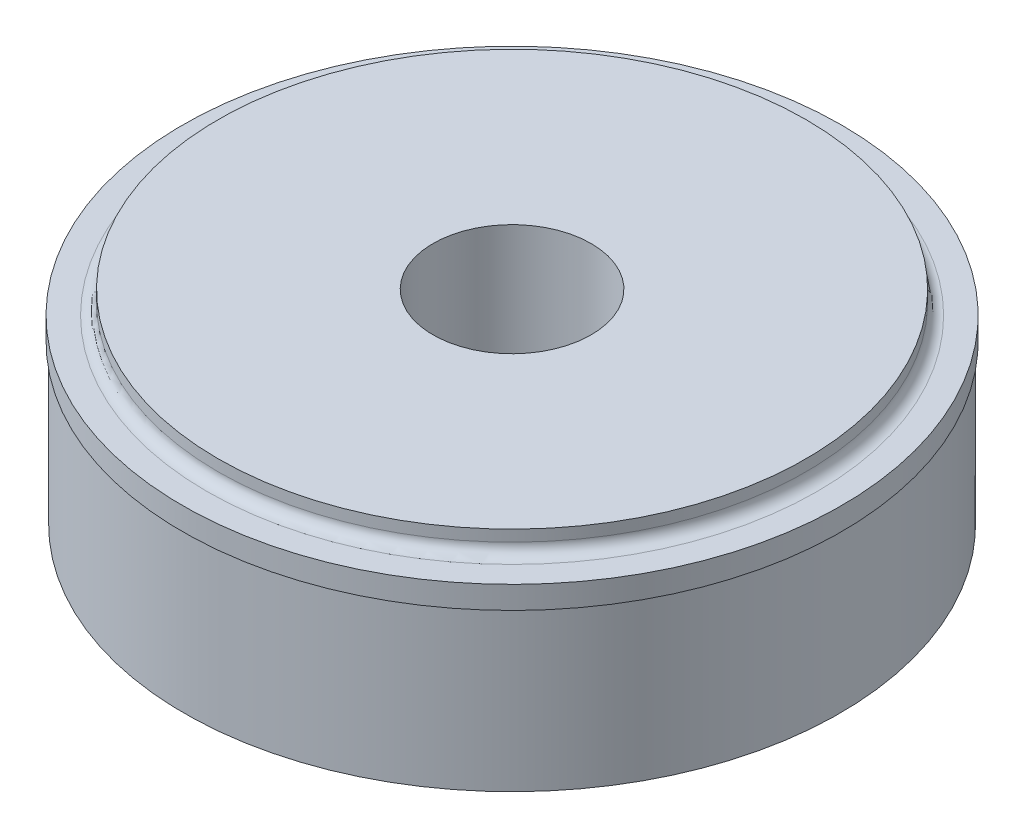
from build123d import *


with BuildPart() as part:
    # 草图1 → 旋转1 (revolve)
    with BuildSketch(Plane(origin=(0, 0, 0), x_dir=(0, 0, -1), z_dir=(1, 0, 0)), mode=Mode.PRIVATE) as revolve_1_sk:
        with BuildLine():
            Line((-17.5, 45), (-17.5, 0))
            Line((-17.5, 0), (-72.5, 0))
            Line((-72.5, 0), (-72.5, 35))
            Line((-72.5, 35), (-72.9, 35))
            Line((-72.9, 35), (-72.9, 40))
            Line((-72.9, 40), (-67.5, 40))
            ThreePointArc((-67.5, 40), (-65.732233047, 40.732233047), (-65, 42.5))
            Line((-65, 42.5), (-65, 45))
            Line((-65, 45), (-17.5, 45))
        make_face()
    revolve(revolve_1_sk.sketch.rotate(Axis((0, 0, 0), (0, 1, 0)), 180), axis=Axis((0, 0, 0), (0, 1, 0)))


solid = part.part
